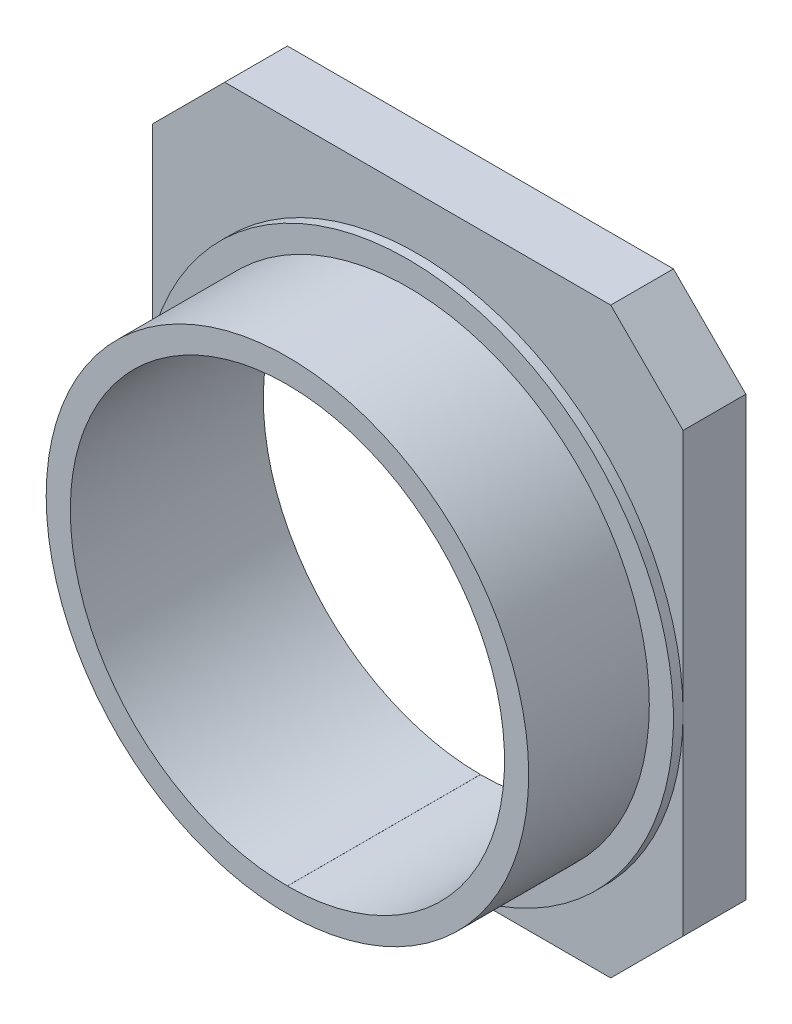
from build123d import *

# Parameters (mm, degrees)
BOSS_EXTRUDE1_DEPTH = 2.6
BOSS_EXTRUDE2_START = 0.4
SKETCH2_R           = 11
BOSS_EXTRUDE2_DEPTH = 0.4
SKETCH3_R           = 10
BOSS_EXTRUDE3_DEPTH = 5


with BuildPart() as part:
    # Sketch1 → Boss-Extrude1 (new body)
    with BuildSketch(Plane.XY):
        Polygon((-101.82751654, -139.254588807), (-109.82751654, -139.254588807), (-112.82751654, -142.254588807), (-112.82751654, -160.410438888), (-109.82751654, -163.410438888), (-101.82751654, -163.410438888), (-93.82751654, -163.410438888), (-90.82751654, -160.410438888), (-90.82751654, -142.254588807), (-93.82751654, -139.254588807), align=None)
        with BuildLine():
            Line((-101.82751654, -161.410438888), (-101.82751654, -161.406823358))
            add(Edge.make_bspline(
                [(-101.82751654, -161.406823358), (-102.422162271, -161.406823358), (-103.006870259, -161.348469799), (-103.869635205, -161.176988515), (-104.154822959, -161.1057322), (-104.720287744, -160.934384241), (-105.001330007, -160.833809548), (-105.818842439, -160.494941156), (-106.33582072, -160.218450477), (-107.314217622, -159.565215144), (-107.777447082, -159.184998049), (-108.607719596, -158.354451471), (-108.980275796, -157.901273798), (-109.473711648, -157.16329018), (-109.626905607, -156.907604181), (-109.904538968, -156.387928298), (-110.155344462, -155.857224862), (-110.353303759, -155.304799077), (-110.524479072, -154.741363777), (-110.596954867, -154.452589203), (-110.770224625, -153.581187835), (-110.827307979, -152.997176095), (-110.827619973, -152.116665053), (-110.813402769, -151.822407076), (-110.755453282, -151.232336564), (-110.711753861, -150.938362019), (-110.539397258, -150.07260899), (-110.369409104, -149.511563453), (-110.031331697, -148.69431731), (-109.903855236, -148.424565494), (-109.625080406, -147.903123691), (-109.473781689, -147.650944456), (-108.985007402, -146.919418072), (-108.612994329, -146.464837975), (-107.773025896, -145.624478569), (-107.317394389, -145.251329051), (-106.586246745, -144.762472579), (-106.334327243, -144.611225122), (-105.813734345, -144.33263421), (-105.543874944, -144.204932828), (-104.725722152, -143.866107062), (-104.164612328, -143.6960009), (-103.011425471, -143.465984444), (-102.414902795, -143.407128867), (-101.82751654, -143.407128867)],
                knots=[0, 0, 0, 0, 0.0625, 0.0625, 0.09375, 0.09375, 0.125, 0.125, 0.1875, 0.1875, 0.25, 0.25, 0.3125, 0.3125, 0.34375, 0.34375, 0.375, 0.40625, 0.40625, 0.4375, 0.4375, 0.5, 0.5, 0.53125, 0.53125, 0.5625, 0.5625, 0.625, 0.625, 0.65625, 0.65625, 0.6875, 0.6875, 0.75, 0.75, 0.8125, 0.8125, 0.84375, 0.84375, 0.875, 0.875, 0.9375, 0.9375, 1, 1, 1, 1], degree=3))
            Line((-101.82751654, -143.407128867), (-101.82751654, -143.410438888))
            ThreePointArc((-101.82751654, -143.410438888), (-92.82751654, -152.410438888), (-101.82751654, -161.410438888))
        make_face(mode=Mode.SUBTRACT)
    extrude(amount=BOSS_EXTRUDE1_DEPTH)

    # Sketch2 → Boss-Extrude2 (add)
    with BuildSketch(Plane(origin=(0, 0, 3), x_dir=(-1, 0, 0), z_dir=(0, 0, -1)).offset(BOSS_EXTRUDE2_START)):
        with Locations(Location((101.82751654, -152.410438888, 0), (0, 0, 270))):
            Circle(SKETCH2_R)
        with BuildLine():
            Line((101.82751654, -161.410438888), (101.82751654, -161.406823358))
            add(Edge.make_bspline(
                [(101.82751654, -161.406823358), (102.422162271, -161.406823358), (103.006870259, -161.348469799), (103.869635205, -161.176988515), (104.154822959, -161.1057322), (104.720287744, -160.934384241), (105.001330007, -160.833809548), (105.818842439, -160.494941156), (106.33582072, -160.218450477), (107.314217622, -159.565215144), (107.777447082, -159.184998049), (108.607719596, -158.354451471), (108.980275796, -157.901273798), (109.473711648, -157.16329018), (109.626905607, -156.907604181), (109.904538968, -156.387928298), (110.155344462, -155.857224862), (110.353303759, -155.304799077), (110.524479072, -154.741363777), (110.596954867, -154.452589203), (110.770224625, -153.581187835), (110.827307979, -152.997176095), (110.827619973, -152.116665053), (110.813402769, -151.822407076), (110.755453282, -151.232336564), (110.711753861, -150.938362019), (110.539397258, -150.07260899), (110.369409104, -149.511563453), (110.031331697, -148.69431731), (109.903855236, -148.424565494), (109.625080406, -147.903123691), (109.473781689, -147.650944456), (108.985007402, -146.919418072), (108.612994329, -146.464837975), (107.773025896, -145.624478569), (107.317394389, -145.251329051), (106.586246745, -144.762472579), (106.334327243, -144.611225122), (105.813734345, -144.33263421), (105.543874944, -144.204932828), (104.725722152, -143.866107062), (104.164612328, -143.6960009), (103.011425471, -143.465984444), (102.414902795, -143.407128867), (101.82751654, -143.407128867)],
                knots=[0, 0, 0, 0, 0.0625, 0.0625, 0.09375, 0.09375, 0.125, 0.125, 0.1875, 0.1875, 0.25, 0.25, 0.3125, 0.3125, 0.34375, 0.34375, 0.375, 0.40625, 0.40625, 0.4375, 0.4375, 0.5, 0.5, 0.53125, 0.53125, 0.5625, 0.5625, 0.625, 0.625, 0.65625, 0.65625, 0.6875, 0.6875, 0.75, 0.75, 0.8125, 0.8125, 0.84375, 0.84375, 0.875, 0.875, 0.9375, 0.9375, 1, 1, 1, 1], degree=3))
            Line((101.82751654, -143.407128867), (101.82751654, -143.410438888))
            ThreePointArc((101.82751654, -143.410438888), (92.82751654, -152.410438888), (101.82751654, -161.410438888))
        make_face(mode=Mode.SUBTRACT)
    extrude(amount=-BOSS_EXTRUDE2_DEPTH)

    # Sketch3 → Boss-Extrude3 (add)
    with BuildSketch(Plane.XY.offset(3)):
        with Locations(Location((-101.82751654, -152.410438888, 0), (0, 0, 180))):
            Circle(SKETCH3_R)
        with BuildLine():
            Line((-101.82751654, -161.406823358), (-101.82751654, -161.410438888))
            ThreePointArc((-101.82751654, -161.410438888), (-92.82751654, -152.410438888), (-101.82751654, -143.410438888))
            Line((-101.82751654, -143.410438888), (-101.82751654, -143.407128867))
            add(Edge.make_bspline(
                [(-101.82751654, -143.407128867), (-102.414902795, -143.407128867), (-103.011425471, -143.465984444), (-104.164612328, -143.6960009), (-104.725722152, -143.866107062), (-105.543874944, -144.204932828), (-105.813734345, -144.33263421), (-106.334327243, -144.611225122), (-106.586246745, -144.762472579), (-107.317394389, -145.251329051), (-107.773025896, -145.624478569), (-108.612994329, -146.464837975), (-108.985007402, -146.919418072), (-109.473781689, -147.650944456), (-109.625080406, -147.903123691), (-109.903855236, -148.424565494), (-110.031331697, -148.69431731), (-110.369409104, -149.511563453), (-110.539397258, -150.07260899), (-110.711753861, -150.938362019), (-110.755453282, -151.232336564), (-110.813402769, -151.822407076), (-110.827619973, -152.116665053), (-110.827307979, -152.997176095), (-110.770224625, -153.581187835), (-110.596954867, -154.452589203), (-110.524479072, -154.741363777), (-110.353303759, -155.304799077), (-110.155344462, -155.857224862), (-109.904538968, -156.387928298), (-109.626905607, -156.907604181), (-109.473711648, -157.16329018), (-108.980275796, -157.901273798), (-108.607719596, -158.354451471), (-107.777447082, -159.184998049), (-107.314217622, -159.565215144), (-106.33582072, -160.218450477), (-105.818842439, -160.494941156), (-105.001330007, -160.833809548), (-104.720287744, -160.934384241), (-104.154822959, -161.1057322), (-103.869635205, -161.176988515), (-103.006870259, -161.348469799), (-102.422162271, -161.406823358), (-101.82751654, -161.406823358)],
                knots=[0, 0, 0, 0, 0.0625, 0.0625, 0.125, 0.125, 0.15625, 0.15625, 0.1875, 0.1875, 0.25, 0.25, 0.3125, 0.3125, 0.34375, 0.34375, 0.375, 0.375, 0.4375, 0.4375, 0.46875, 0.46875, 0.5, 0.5, 0.5625, 0.5625, 0.59375, 0.59375, 0.625, 0.65625, 0.65625, 0.6875, 0.6875, 0.75, 0.75, 0.8125, 0.8125, 0.875, 0.875, 0.90625, 0.90625, 0.9375, 0.9375, 1, 1, 1, 1], degree=3))
        make_face(mode=Mode.SUBTRACT)
    extrude(amount=BOSS_EXTRUDE3_DEPTH)


solid = part.part
